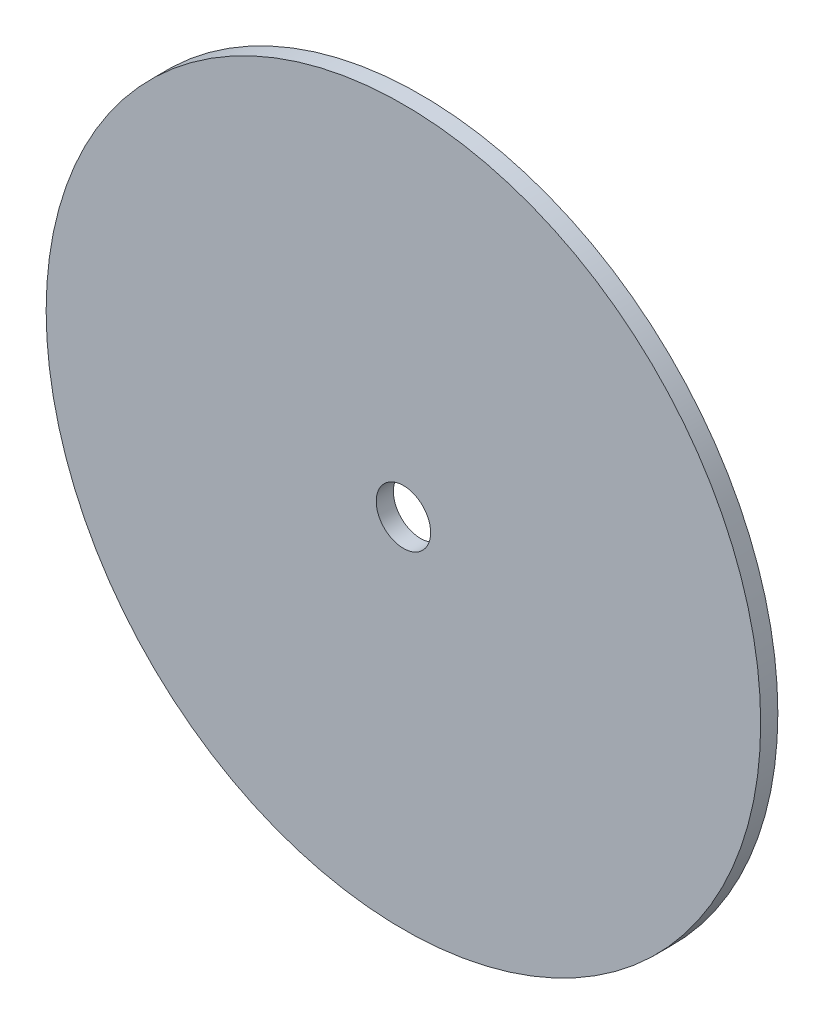
from build123d import *

# Parameters (mm, degrees)
SKETCH1_W = 6
SKETCH1_H = 115.475


with BuildPart() as part:
    # Sketch1 → Revolve1 (revolve)
    with BuildSketch(Plane(origin=(0, 0, 0), x_dir=(0, 0, -1), z_dir=(1, 0, 0)), mode=Mode.PRIVATE) as revolve1_sk:
        with Locations((3, 67.2625)):
            Rectangle(SKETCH1_W, SKETCH1_H)
    revolve(revolve1_sk.sketch.rotate(Axis((0, 0, 0), (0, 0, -1)), 90), axis=Axis((0, 0, 0), (0, 0, -1)))


solid = part.part
